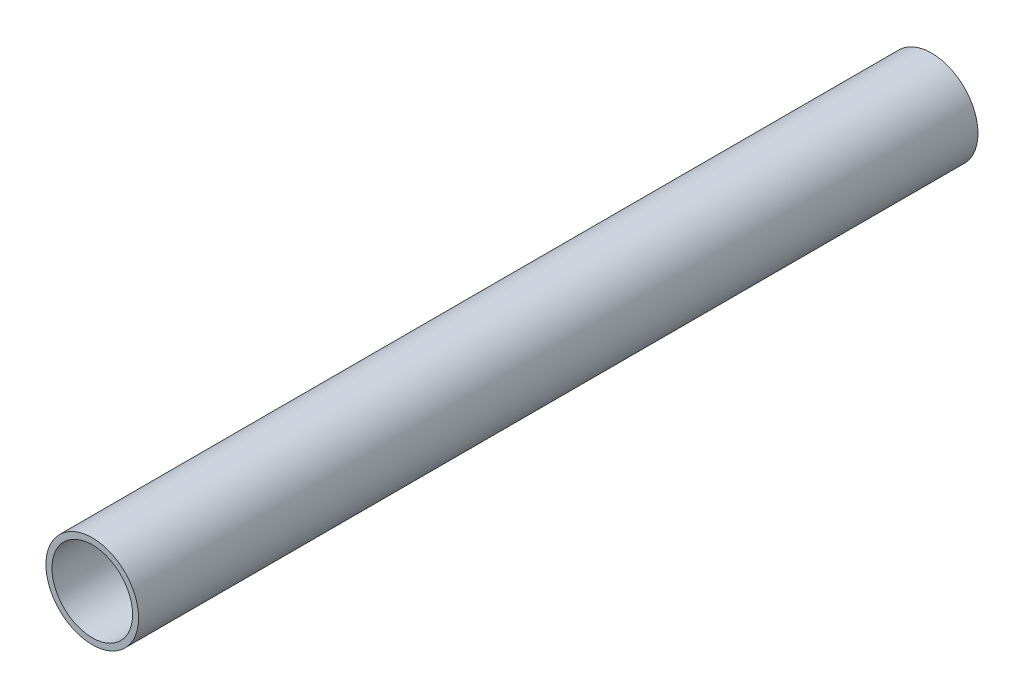
from build123d import *

# Parameters (mm, degrees)
SKETCH1_R           = 84.1375
SKETCH1_R_2         = 73.1647
EXTRUDE_THIN1_DEPTH = 762


with BuildPart() as part:
    # Sketch1 → Extrude-Thin1 (new, symmetric)
    with BuildSketch(Plane.XY):
        Circle(SKETCH1_R)
        Circle(SKETCH1_R_2, mode=Mode.SUBTRACT)
    extrude(amount=EXTRUDE_THIN1_DEPTH, both=True)


solid = part.part
